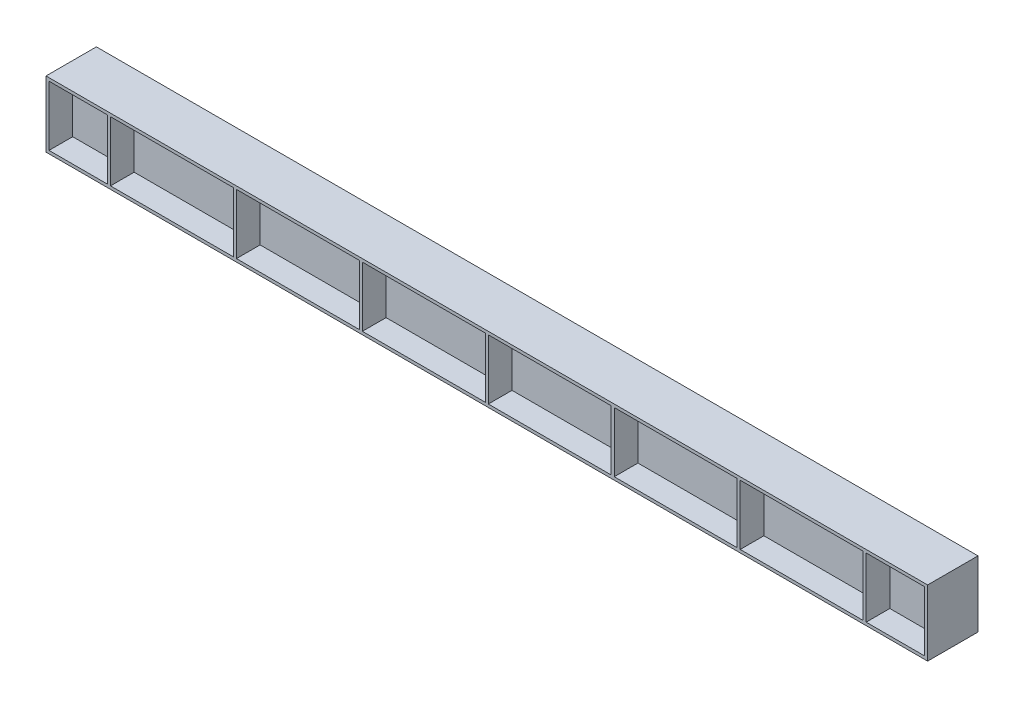
from build123d import *

# Parameters (mm, degrees)
SKETCH_1_W           = 3500
SKETCH_1_H           = 262
EXTRUDE_1_DEPTH      = 200
SKETCH_5_W           = 232
SKETCH_5_H           = 238
SKETCH_5_W_2         = 488
CUT_EXTRUDE_10_DEPTH = 3516.486310598
SKETCH_7_W           = 3500
SKETCH_7_H           = 12
EXTRUDE_13_DEPTH     = 260


with BuildPart() as part:
    # 草图1 → 拉伸1 (new body)
    with BuildSketch(Plane.XY):
        with Locations((1750, 131)):
            Rectangle(SKETCH_1_W, SKETCH_1_H)
    extrude(amount=EXTRUDE_1_DEPTH)

    # 草图5 → 拉伸10 (cut, through all)
    with BuildSketch(Plane.XY.offset(200)):
        with Locations((128, 131)):
            Rectangle(SKETCH_5_W, SKETCH_5_H)
        with Locations((500, 131)):
            Rectangle(SKETCH_5_W_2, SKETCH_5_H)
        with Locations((1000, 131)):
            Rectangle(SKETCH_5_W_2, SKETCH_5_H)
        with Locations((1500, 131)):
            Rectangle(SKETCH_5_W_2, SKETCH_5_H)
        with Locations((2000, 131)):
            Rectangle(SKETCH_5_W_2, SKETCH_5_H)
        with Locations((2500, 131)):
            Rectangle(SKETCH_5_W_2, SKETCH_5_H)
        with Locations((3000, 131)):
            Rectangle(SKETCH_5_W_2, SKETCH_5_H)
        with Locations((3372, 131)):
            Rectangle(SKETCH_5_W, SKETCH_5_H)
    extrude(amount=-CUT_EXTRUDE_10_DEPTH, mode=Mode.SUBTRACT)

    # 草图7 → 拉伸13 (add)
    with BuildSketch(Plane.XZ):
        with Locations((1750, 100)):
            Rectangle(SKETCH_7_W, SKETCH_7_H)
    extrude(amount=-EXTRUDE_13_DEPTH)


solid = part.part
